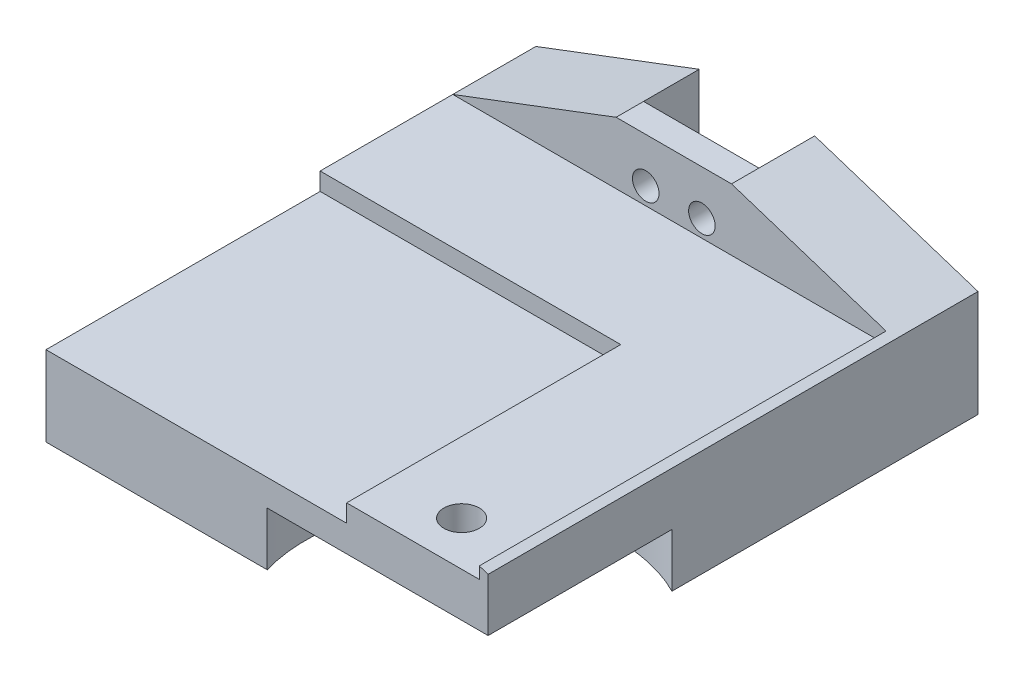
from build123d import *

# Parameters (mm, degrees)
OUTLINESKETCH2_W                           = 50
OUTLINESKETCH2_H                           = 55.4
OUTLINESKETCH2_R                           = 2
OUTLINEBOSS_EXTRUDE1_DEPTH                 = 18.05
BUILDPLATECUTOUTSKETCH1_W                  = 49
BUILDPLATECUTOUTSKETCH1_H                  = 46
BUILDPLATECUTOUTCUT_EXTRUDE7_DEPTH         = 7
MICROSWITCHSKETCH9_W                       = 13.05
MICROSWITCHSKETCH9_H                       = 12.05
MICROSWITCHCUT_EXTRUDE6_DEPTH              = 6.3
MICROSWITCHMOUNTINGHOLESSKETCH10_R         = 1.5
MICROSWITCHMOUNTINGHOLESCUT_EXTRUDE4_DEPTH = 3.1
CABLECUTCUT_EXTRUDE5_DEPTH                 = 76.59340249
HEATMATCUTSKETCH3_W                        = 34
HEATMATCUTSKETCH3_H                        = 31
HEATMATCUT_EXTRUDE8_DEPTH                  = 2
BALLJOINTCUT_EXTRUDE9_DEPTH                = 6.05
CHAMFER1_SIZE                              = 7
CHAMFER1_SIZE2                             = 18.475
CHAMFER2_SIZE                              = 6
CHAMFER2_SIZE2                             = 18.475


with BuildPart() as part:
    # OutlineSketch2 → OutlineBoss-Extrude1 (new body)
    with BuildSketch(Plane(origin=(0, 0, 0), x_dir=(1, 0, 0), z_dir=(0, 1, 0))):
        with Locations((25, 27.7)):
            Rectangle(OUTLINESKETCH2_W, OUTLINESKETCH2_H)
        with Locations(Location((42, 5, 0), (0, 0, 270))):
            Circle(OUTLINESKETCH2_R, mode=Mode.SUBTRACT)
    extrude(amount=OUTLINEBOSS_EXTRUDE1_DEPTH)

    # BuildPlateCutoutSketch1 → BuildPlateCutoutCut-Extrude7 (cut)
    with BuildSketch(Plane(origin=(0, 18.05, 0), x_dir=(1, 0, 0), z_dir=(0, 1, 0))):
        with Locations((24.5, 23)):
            Rectangle(BUILDPLATECUTOUTSKETCH1_W, BUILDPLATECUTOUTSKETCH1_H)
    extrude(amount=-BUILDPLATECUTOUTCUT_EXTRUDE7_DEPTH, mode=Mode.SUBTRACT)

    # MicroSwitchSketch9 → MicroSwitchCut-Extrude6 (cut)
    with BuildSketch(Plane(origin=(0, 0, -55.4), x_dir=(-1, 0, 0), z_dir=(0, 0, -1))):
        with Locations((-25, 12.025)):
            Rectangle(MICROSWITCHSKETCH9_W, MICROSWITCHSKETCH9_H)
    extrude(amount=-MICROSWITCHCUT_EXTRUDE6_DEPTH, mode=Mode.SUBTRACT)

    # MicroSwitchMountingHolesSketch10 → MicroSwitchMountingHolesCut-Extrude4 (cut)
    with BuildSketch(Plane(origin=(0, 0, -49.1), x_dir=(-1, 0, 0), z_dir=(0, 0, -1))):
        with Locations((-28.175, 13)):
            Circle(MICROSWITCHMOUNTINGHOLESSKETCH10_R)
        with Locations((-21.825, 13)):
            Circle(MICROSWITCHMOUNTINGHOLESSKETCH10_R)
    extrude(amount=-MICROSWITCHMOUNTINGHOLESCUT_EXTRUDE4_DEPTH, mode=Mode.SUBTRACT)

    # CableCutSketch11 → CableCutCut-Extrude5 (cut, through all)
    with BuildSketch(Plane(origin=(0, 6, 0), x_dir=(1, 0, 0), z_dir=(0, 1, 0))):
        Polygon((24.125, 55.4), (24.125, 53.65), (23.125, 53.65), (23.125, 51.9), (26.875, 51.9), (26.875, 53.65), (25.875, 53.65), (25.875, 55.4), align=None)
    extrude(amount=-CABLECUTCUT_EXTRUDE5_DEPTH, mode=Mode.SUBTRACT)

    # HeatMatCutSketch3 → HeatMatCut-Extrude8 (cut)
    with BuildSketch(Plane(origin=(0, 11.05, 0), x_dir=(1, 0, 0), z_dir=(0, 1, 0))):
        with Locations((17, 15.5)):
            Rectangle(HEATMATCUTSKETCH3_W, HEATMATCUTSKETCH3_H)
    extrude(amount=-HEATMATCUT_EXTRUDE8_DEPTH, mode=Mode.SUBTRACT)

    # BallJointCutoutSketch4 → BallJointCut-Extrude9 (cut)
    with BuildSketch(Plane.XZ):
        with BuildLine():
            Line((25.020895194, 0), (50, 0))
            Line((50, 0), (50, -20.788920166))
            ThreePointArc((50, -20.788920166), (30.677417203, -18.604746187), (25.020895194, 0))
        make_face()
    extrude(amount=-BALLJOINTCUT_EXTRUDE9_DEPTH, mode=Mode.SUBTRACT)

    # Chamfer1
    chamfer1_edges = [part.edges().sort_by_distance(p)[0] for p in [
        (0, 18.05, -50.7),
    ]]
    chamfer1_side = [part.faces().sort_by_distance(p)[0] for p in [
        (0, 6.03362055, -31.38491972),
    ]]
    chamfer(chamfer1_edges, length=CHAMFER1_SIZE, length2=CHAMFER1_SIZE2, reference=chamfer1_side[0])

    # Chamfer2
    chamfer2_edges = [part.edges().sort_by_distance(p)[0] for p in [
        (50, 18.05, -27.7),
    ]]
    chamfer2_side = [part.faces().sort_by_distance(p)[0] for p in [
        (50, 9.888235373, -30.189792368),
    ]]
    chamfer(chamfer2_edges, length=CHAMFER2_SIZE, length2=CHAMFER2_SIZE2, reference=chamfer2_side[0])


solid = part.part
